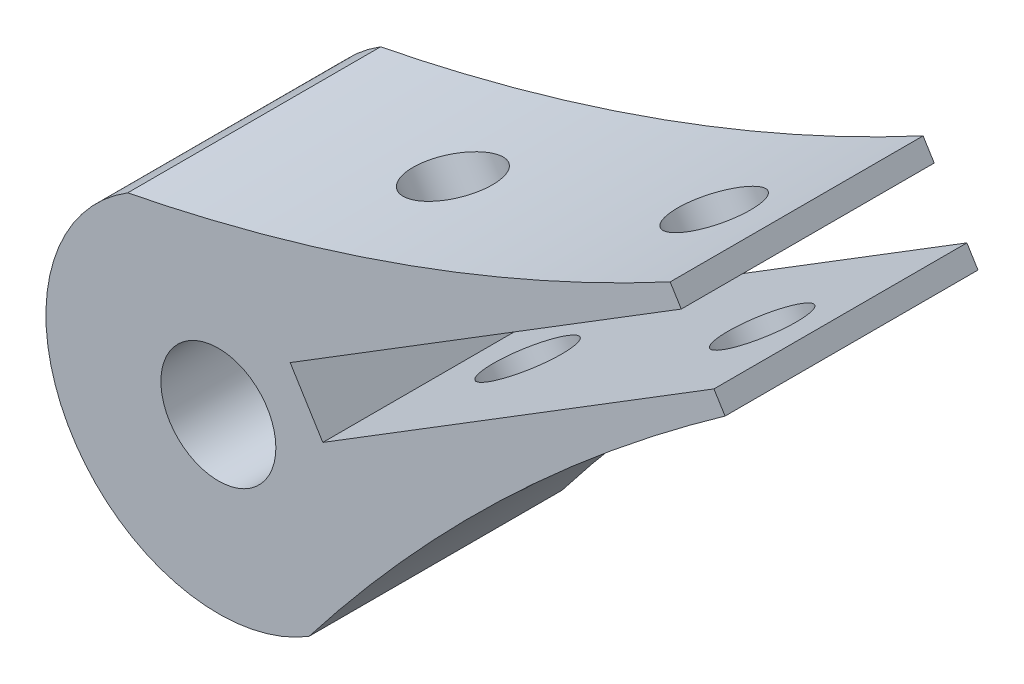
from build123d import *

# Parameters (mm, degrees)
SKETCH2_R           = 2.5
BOSS_EXTRUDE1_DEPTH = 11
SKETCH3_R           = 1.75
CUT_EXTRUDE1_DEPTH  = 30.961226777


with BuildPart() as part:
    # Sketch2 → Boss-Extrude1 (new body)
    with BuildSketch(Plane.XY):
        with BuildLine():
            Line((19.64777021, 14.82081493), (20.13151796, 14.038683694))
            Line((20.13151796, 14.038683694), (3.122043563, 3.518332904))
            Line((3.122043563, 3.518332904), (4.542290919, 1.222053861))
            Line((4.542290919, 1.222053861), (21.551765317, 11.74240465))
            Line((21.551765317, 11.74240465), (22.035513067, 10.960273414))
            add(Edge.make_bspline(
                [(3.945113039, -6.378564346), (11.703739539, 3.65165423), (22.035513067, 10.960273414)],
                knots=[0, 0, 0, 1, 1, 1], degree=2))
            ThreePointArc((3.945113039, -6.378564346), (-6.378571406, -3.945142993), (-3.945150053, 6.378541452))
            add(Edge.make_bspline(
                [(-3.945150053, 6.378541452), (8.494257916, 8.84079636), (19.64777021, 14.82081493)],
                knots=[0, 0, 0, 1, 1, 1], degree=2))
        make_face()
        with Locations((-1.8507e-05, -1.1447e-05)):
            Circle(SKETCH2_R, mode=Mode.SUBTRACT)
    extrude(amount=BOSS_EXTRUDE1_DEPTH)

    # Sketch3 → Cut-Extrude1 (cut, through all)
    with BuildSketch(Plane(origin=(3.945131546, -6.378552899, 0), x_dir=(0, 0, -1), z_dir=(0.5260175394579771, -0.8504737198659202, 0))):
        with Locations(Location((-5.5, 20.50592082, 0), (0, 0, 90))):
            Circle(SKETCH3_R)
        with Locations(Location((-5.5, 8.50592082, 0), (0, 0, 90))):
            Circle(SKETCH3_R)
    extrude(amount=-CUT_EXTRUDE1_DEPTH, mode=Mode.SUBTRACT)


solid = part.part
